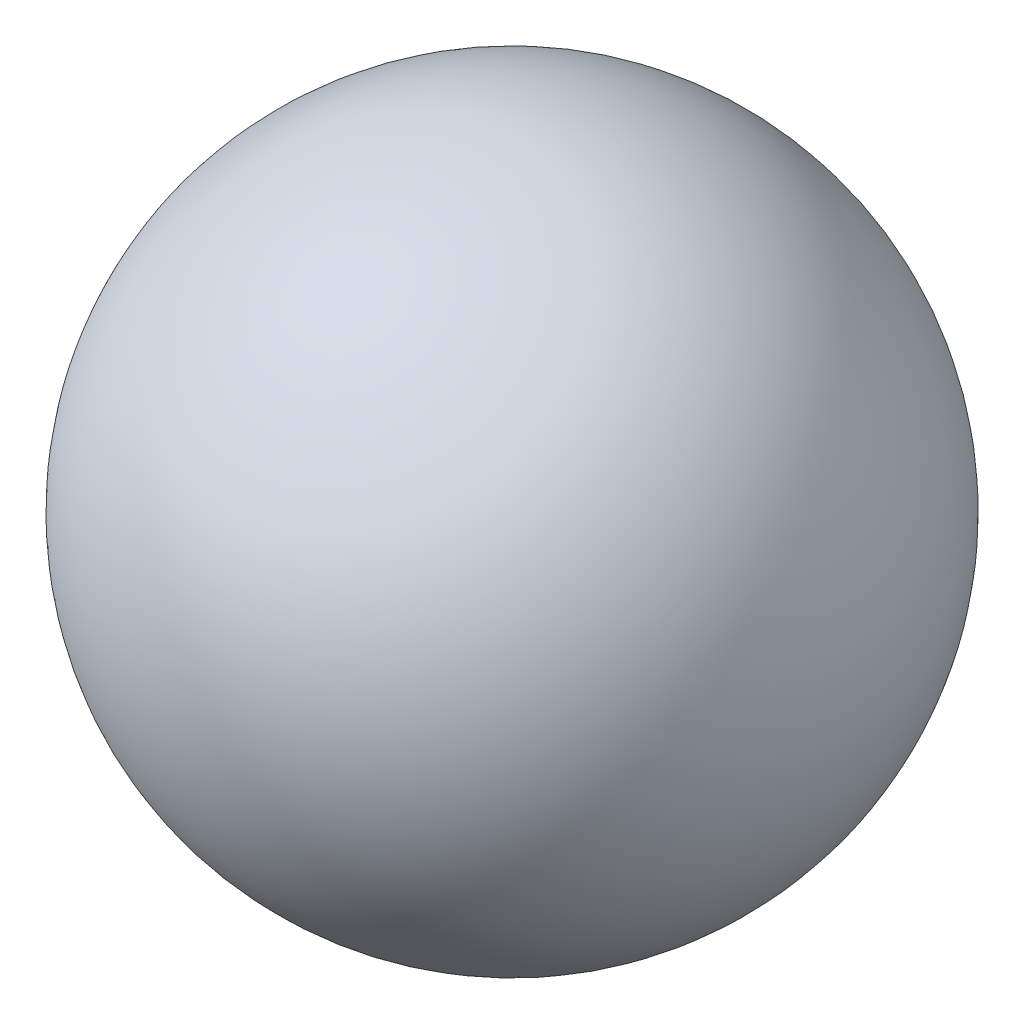
from build123d import *


with BuildPart() as part:
    # Esquisse1 → Base-Révolution (revolve)
    with BuildSketch(Plane.XY):
        with BuildLine():
            Line((-2.428571429, 11.75), (2.428571429, 11.75))
            ThreePointArc((2.428571429, 11.75), (0, 14.178571429), (-2.428571429, 11.75))
        make_face()
    revolve(axis=Axis((4.887863217, 11.75, 0), (-1, 0, 0)))


solid = part.part
